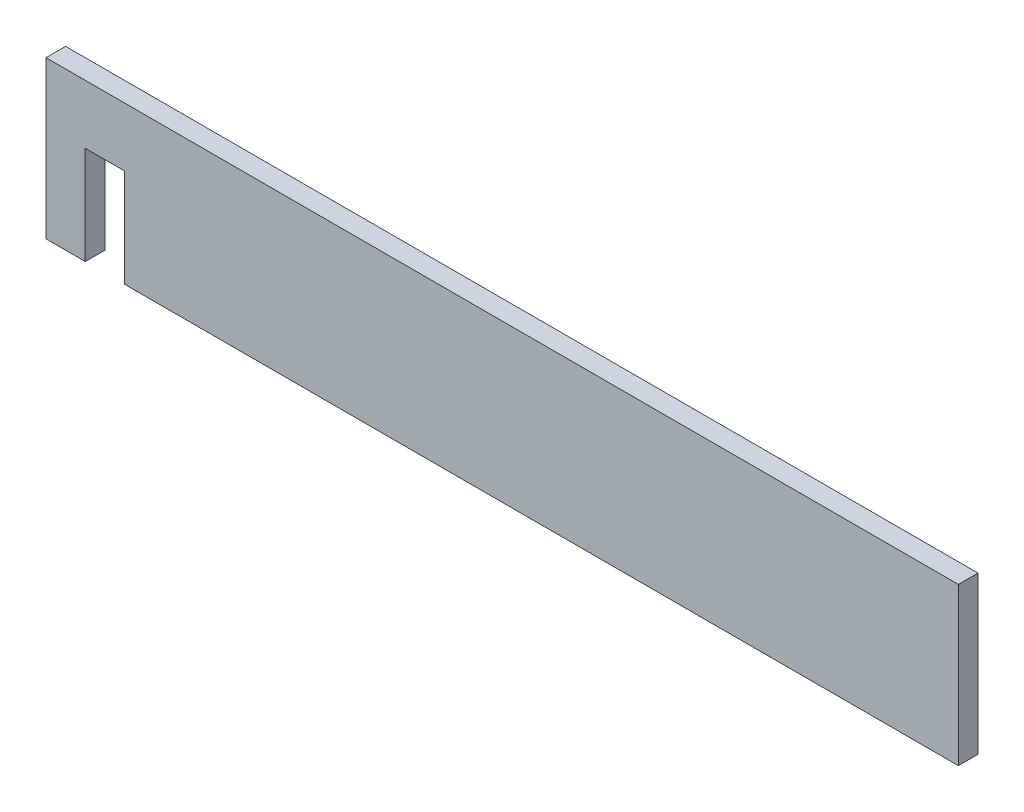
from build123d import *

# Parameters (mm, degrees)
BOSS_EXTRUDE1_DEPTH = 2.54


with BuildPart() as part:
    # Sketch1 → Boss-Extrude1 (new body)
    with BuildSketch(Plane.XY):
        Polygon((10.16, 0), (118.11, 0), (118.11, 20.32), (0, 20.32), (0, 0), (5.08, 0), (5.08, 12.7), (10.16, 12.7), align=None)
    extrude(amount=BOSS_EXTRUDE1_DEPTH)


solid = part.part
